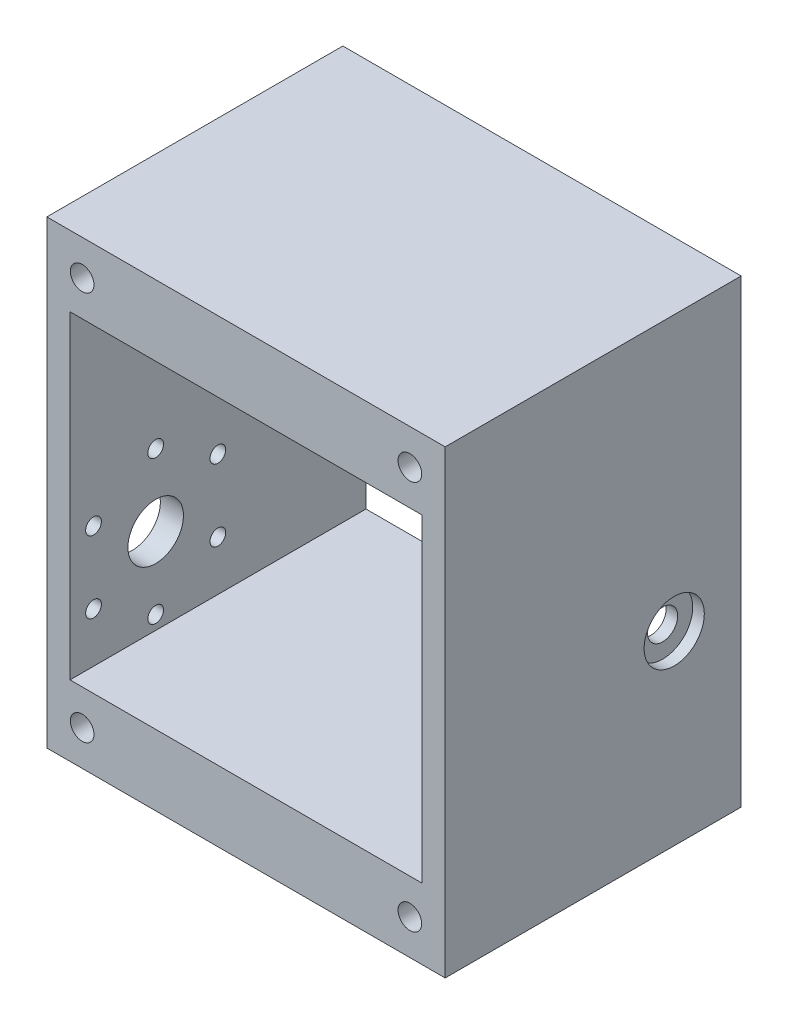
from build123d import *

# Parameters (mm, degrees)
SKETCH1_W                                       = 85.999999704
SKETCH1_H                                       = 99.314
BOSS_EXTRUDE1_DEPTH                             = 63.903125051
SKETCH2_W                                       = 75.999999892
SKETCH2_H                                       = 68.834
CUT_EXTRUDE1_DEPTH                              = 92.642932229
F_6_5_6_5_DIAMETER_HOLE1_D                      = 6.5
F_6_5_6_5_DIAMETER_HOLE1_DEPTH                  = 4.999999906
F_12_0_12_DIAMETER_HOLE1_D                      = 12
F_12_0_12_DIAMETER_HOLE1_DEPTH                  = 4.999999906
CSK_FOR_M3_FLAT_HEAD_MACHINE_SCREW1_D           = 3.4
CSK_FOR_M3_FLAT_HEAD_MACHINE_SCREW1_DEPTH       = 4.999999906
CSK_FOR_M3_FLAT_HEAD_MACHINE_SCREW1_CSINK_D     = 6.3
CSK_FOR_M3_FLAT_HEAD_MACHINE_SCREW1_CSINK_ANGLE = 90
F_10_CLEARANCE_HOLE1_D                          = 5.1054
SKETCH12_R                                      = 6.499999954
CUT_EXTRUDE2_DEPTH                              = 2.499999953


with BuildPart() as part:
    # Sketch1 → Boss-Extrude1 (new body)
    with BuildSketch(Plane.XY):
        Rectangle(SKETCH1_W, SKETCH1_H)
    extrude(amount=BOSS_EXTRUDE1_DEPTH)

    # Sketch2 → Cut-Extrude1 (cut, through all)
    with BuildSketch(Plane.XY.offset(63.903125051)):
        Rectangle(SKETCH2_W, SKETCH2_H)
    extrude(amount=-CUT_EXTRUDE1_DEPTH, mode=Mode.SUBTRACT)

    # Ø6.5 (6.5) Diameter Hole1
    with Locations(Plane(origin=(42.999999852, 0, 0), x_dir=(0, 0, -1), z_dir=(1, 0, 0))):
        with Locations((-14.450199954, -9.525)):
            Hole(F_6_5_6_5_DIAMETER_HOLE1_D / 2, depth=F_6_5_6_5_DIAMETER_HOLE1_DEPTH)

    # Ø12.0 (12) Diameter Hole1
    with Locations(Plane.ZY.offset(42.999999852)):
        with Locations((45.403125094, -15.917000043)):
            Hole(F_12_0_12_DIAMETER_HOLE1_D / 2, depth=F_12_0_12_DIAMETER_HOLE1_DEPTH)

    # CSK for M3 Flat Head Machine Screw1
    with Locations(Plane.ZY.offset(42.999999852)):
        with Locations((45.403125094, -0.417000055), (58.826518842, -8.167000049), (58.826518842, -23.667000037), (45.403125094, -31.417000031), (31.979731346, -23.667000037), (31.979731346, -8.167000049)):
            CounterSinkHole(CSK_FOR_M3_FLAT_HEAD_MACHINE_SCREW1_D / 2, CSK_FOR_M3_FLAT_HEAD_MACHINE_SCREW1_CSINK_D / 2, depth=CSK_FOR_M3_FLAT_HEAD_MACHINE_SCREW1_DEPTH, counter_sink_angle=CSK_FOR_M3_FLAT_HEAD_MACHINE_SCREW1_CSINK_ANGLE)

    # #10 Clearance Hole1 (through all)
    with Locations(Plane.XY.offset(63.903125051)):
        with Locations((-35.379999852, 42.037), (35.379999852, 42.037), (-35.379999852, -42.037), (35.379999852, -42.037)):
            Hole(F_10_CLEARANCE_HOLE1_D / 2)

    # Sketch12 → Cut-Extrude2 (cut)
    with BuildSketch(Plane(origin=(42.999999852, 0, 0), x_dir=(0, 0, -1), z_dir=(1, 0, 0))):
        with Locations((-14.450199954, -9.525)):
            Circle(SKETCH12_R)
    extrude(amount=-CUT_EXTRUDE2_DEPTH, mode=Mode.SUBTRACT)


solid = part.part
